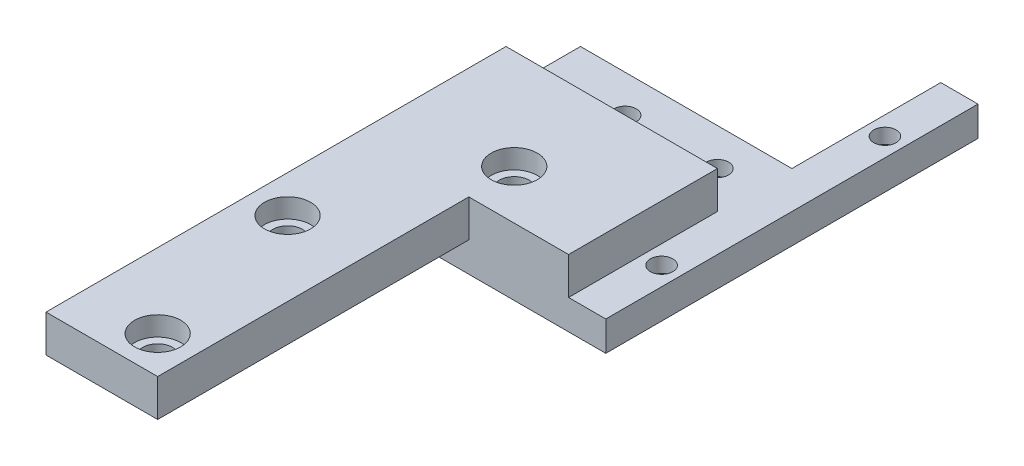
from build123d import *

# Parameters (mm, degrees)
SKETCH_4_W          = 28.4
SKETCH_4_H          = 61.796304386
EXTRUDE_1_DEPTH     = 5
CUT_EXTRUDE_START   = 5
SKETCH_4_4_R        = 3.1
CUT_EXTRUDE_1_DEPTH = 2.6
SKETCH_4_5_R        = 2
CUT_EXTRUDE_2_DEPTH = 74.193425166
SKETCH_4_6_W        = 13.4
SKETCH_4_6_H        = 41.796304386
CUT_EXTRUDE_3_DEPTH = 69.193425166
SKETCH_5_W          = 5
SKETCH_5_H          = 20
EXTRUDE_2_DEPTH     = 4
SKETCH_5_3_R        = 1.5
CUT_EXTRUDE_5_DEPTH = 69.193425166
CUT_EXTRUDE_START_2 = 4
SKETCH_5_4_R        = 2.25
CUT_EXTRUDE_7_DEPTH = 2


with BuildPart() as part:
    # 草图4 → 凸台-拉伸1 (new body)
    with BuildSketch(Plane(origin=(0, 0, 0), x_dir=(1, 0, 0), z_dir=(0, 1, 0))):
        with Locations((-14.2, -30.898152193)):
            Rectangle(SKETCH_4_W, SKETCH_4_H)
    extrude(amount=EXTRUDE_1_DEPTH)

    # 草图4<4> → 切除-拉伸1 (cut)
    with BuildSketch(Plane(origin=(0, 0, 0), x_dir=(1, 0, 0), z_dir=(0, 1, 0)).offset(CUT_EXTRUDE_START)):
        with Locations(Location((-13.9, -13.4, 0), (0, 0, 90))):
            Circle(SKETCH_4_4_R)
        with Locations(Location((-23.4, -34.346360066, 0), (0, 0, 90))):
            Circle(SKETCH_4_4_R)
        with Locations(Location((-18.4, -56.796304386, 0), (0, 0, 90))):
            Circle(SKETCH_4_4_R)
    extrude(amount=-CUT_EXTRUDE_1_DEPTH, mode=Mode.SUBTRACT)

    # 草图4<5> → 切除-拉伸2 (cut, through all)
    with BuildSketch(Plane(origin=(0, 0, 0), x_dir=(1, 0, 0), z_dir=(0, 1, 0)).offset(CUT_EXTRUDE_START)):
        with Locations(Location((-13.9, -13.4, 0), (0, 0, 90))):
            Circle(SKETCH_4_5_R)
        with Locations(Location((-23.4, -34.346360066, 0), (0, 0, 90))):
            Circle(SKETCH_4_5_R)
        with Locations(Location((-18.4, -56.796304386, 0), (0, 0, 90))):
            Circle(SKETCH_4_5_R)
    extrude(amount=-CUT_EXTRUDE_2_DEPTH, mode=Mode.SUBTRACT)

    # 草图4<6> → 切除-拉伸3 (cut, through all)
    with BuildSketch(Plane(origin=(0, 0, 0), x_dir=(1, 0, 0), z_dir=(0, 1, 0))):
        with Locations((-6.7, -40.898152193)):
            Rectangle(SKETCH_4_6_W, SKETCH_4_6_H)
    extrude(amount=CUT_EXTRUDE_3_DEPTH, mode=Mode.SUBTRACT)

    # 草图5 → 凸台-拉伸2 (add)
    with BuildSketch(Plane.XZ):
        Polygon((5, -10), (5, 20), (-28.4, 20), (-28.4, -10), (0, -10), align=None)
        with Locations((2.5, -20)):
            Rectangle(SKETCH_5_W, SKETCH_5_H)
    extrude(amount=EXTRUDE_2_DEPTH)

    # 草图5<3> → 切除-拉伸5 (cut, through all)
    with BuildSketch(Plane.XZ):
        with Locations(Location((-17.4, -5, 0), (0, 0, 270))):
            Circle(SKETCH_5_3_R)
        with Locations(Location((-5, -5, 0), (0, 0, 270))):
            Circle(SKETCH_5_3_R)
        with Locations(Location((2.5, 10, 0), (0, 0, 270))):
            Circle(SKETCH_5_3_R)
        with Locations(Location((2.5, -20, 0), (0, 0, 270))):
            Circle(SKETCH_5_3_R)
    extrude(amount=CUT_EXTRUDE_5_DEPTH, mode=Mode.SUBTRACT)

    # 草图5<4> → 切除-拉伸7 (cut)
    with BuildSketch(Plane.XZ.offset(CUT_EXTRUDE_START_2)):
        with Locations(Location((-17.4, -5, 0), (0, 0, 270))):
            Circle(SKETCH_5_4_R)
        with Locations(Location((-5, -5, 0), (0, 0, 270))):
            Circle(SKETCH_5_4_R)
        with Locations(Location((2.5, 10, 0), (0, 0, 270))):
            Circle(SKETCH_5_4_R)
        with Locations(Location((2.5, -20, 0), (0, 0, 270))):
            Circle(SKETCH_5_4_R)
    extrude(amount=-CUT_EXTRUDE_7_DEPTH, mode=Mode.SUBTRACT)


solid = part.part
